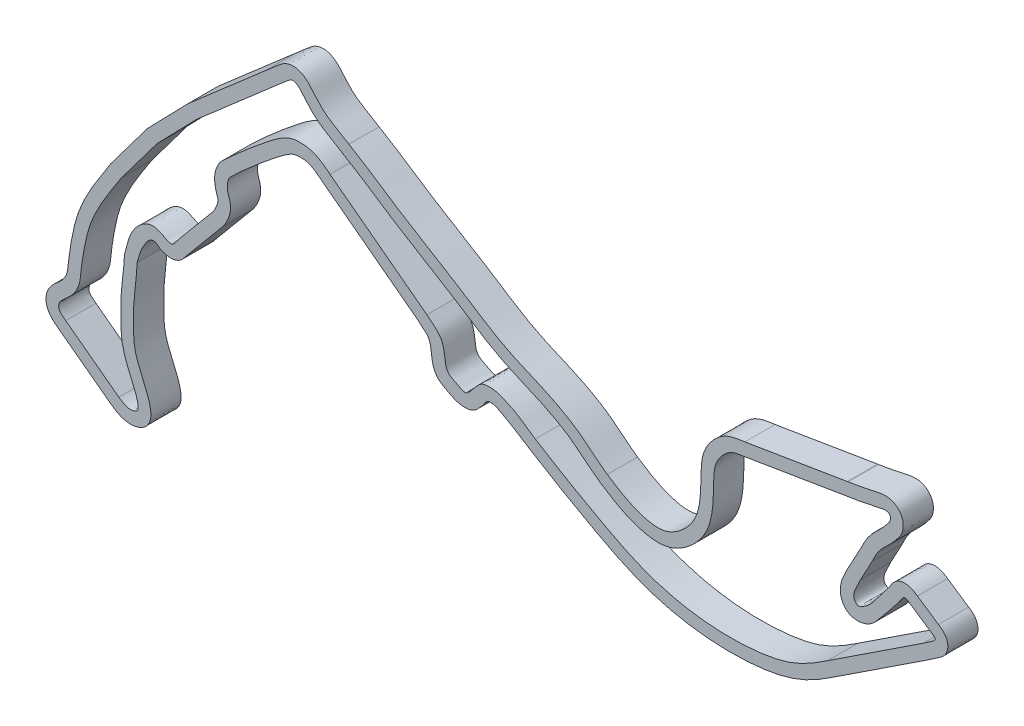
from build123d import *

# Parameters (mm, degrees)
BOSS_EXTRUDE1_DEPTH = 10


with BuildPart() as part:
    # Sketch1 → Boss-Extrude1 (new body)
    with BuildSketch(Plane.XY):
        with BuildLine():
            add(Edge.make_bspline(
                [(196.234526757, 68.630313455), (196.863164007, 68.208189066), (198.137058601, 67.368154228), (200.652516145, 65.805864581), (203.802944502, 64.089898411), (207.645503281, 62.552015627), (210.952028749, 61.795828065), (213.357323761, 61.693823652), (214.947841928, 61.868663308), (216.533068247, 62.334788007), (218.70015008, 63.347315016), (221.368677373, 65.305430073), (223.590618069, 67.769089936), (224.927043037, 69.875454655), (225.701031814, 71.500631519), (226.276899439, 73.263195499), (226.836601338, 75.863075065), (227.105142885, 78.746119853), (227.209174969, 81.80184881), (227.247932708, 83.766687813), (227.285667366, 85.379739898), (227.370084537, 87.155157869), (227.618587659, 89.140469495), (228.268239137, 91.289887574), (229.266557438, 93.447059143), (230.875387167, 95.708061823), (232.753166642, 97.5456105), (234.409057167, 98.728499584), (235.802883373, 99.458190286), (237.243970763, 99.958741433), (238.655976068, 100.28271843), (239.873818858, 100.485156121), (240.923853025, 100.639413146), (241.510026595, 100.721855255), (241.795543314, 100.761883126)],
                knots=[0.000551841, 0.000551841, 0.000551841, 0.000551841, 0.031770571, 0.062989301, 0.125426761, 0.187864221, 0.250301681, 0.281520411, 0.312739141, 0.343957871, 0.375176601, 0.437614061, 0.500051521, 0.531270251, 0.562488981, 0.593707711, 0.624926441, 0.687363901, 0.718582631, 0.74980136, 0.765410725, 0.78102009, 0.81223882, 0.827848185, 0.84345755, 0.87467628, 0.90589501, 0.921504375, 0.93711374, 0.952723105, 0.96833247, 0.983941835, 0.991746518, 0.9995512, 0.9995512, 0.9995512, 0.9995512], degree=3))
            Line((241.795543314, 100.761883126), (275.732195558, 106.3754647))
            Line((275.732195558, 106.3754647), (276.417618534, 102.231771258))
            Line((276.417618534, 102.231771258), (242.42985729, 96.609735563))
            add(Edge.make_bspline(
                [(193.858460131, 65.166788867), (197.968942741, 62.404891637), (204.622812769, 58.416895192), (216.223853845, 56.740775009), (224.585516598, 61.849002139), (230.247353794, 69.676978159), (231.361605554, 77.604093227), (231.444623149, 84.62242306), (231.664088974, 90.31839846), (236.479929402, 95.751342639), (239.166359878, 96.152366989), (242.42985729, 96.609735563)],
                knots=[0, 0, 0, 0, 0.196170733, 0.307152081, 0.445248226, 0.559693045, 0.682149618, 0.754045742, 0.833197903, 0.91443926, 1, 1, 1, 1], degree=3))
            add(Edge.make_bspline(
                [(108.432203873, 116.988121532), (114.126991534, 113.711788129), (125.456933398, 105.623426241), (143.607249619, 95.381303818), (159.43475912, 84.228130675), (173.49140335, 78.985615087), (184.959630652, 72.764552204), (189.446398996, 68.255597223), (193.858460131, 65.166788867)],
                knots=[0, 0, 0, 0, 0.196769887, 0.416049554, 0.62549462, 0.77064201, 0.869433241, 1, 1, 1, 1], degree=3))
            Line((108.432203873, 116.988121532), (110.640197311, 120.563207895))
            add(Edge.make_bspline(
                [(110.640197311, 120.563207895), (111.539005521, 120.044602162), (113.364389861, 118.955106735), (116.949095551, 116.700673271), (121.350772385, 113.782327508), (126.500541127, 110.345587387), (133.414953441, 106.024574697), (140.604074339, 101.80676755), (147.841285424, 97.25990834), (153.095359082, 93.796974998), (157.404572606, 91.076999509), (160.854760386, 89.087856333), (163.438552142, 87.719795895), (166.086380439, 86.468821691), (169.783379136, 84.847787093), (174.635145725, 82.81858748), (179.735034842, 80.367005618), (183.628906038, 78.138626504), (186.411930786, 76.309862657), (188.860256364, 74.422838), (190.751496836, 72.86277083), (192.299404144, 71.601175269), (193.508800918, 70.64081594), (194.587417425, 69.818930313), (195.503447323, 69.148019193), (195.992214942, 68.800176884), (196.234526757, 68.630313455)],
                knots=[0.001261936, 0.001261936, 0.001261936, 0.001261936, 0.031239258, 0.062478515, 0.12495703, 0.187435545, 0.24991406, 0.37487109, 0.437349605, 0.49982812, 0.562306636, 0.593545893, 0.624785151, 0.656024408, 0.687263666, 0.749742181, 0.812220696, 0.843459953, 0.874699211, 0.905938468, 0.937177726, 0.952797355, 0.968416983, 0.984036612, 0.991846427, 0.999656241, 0.999656241, 0.999656241, 0.999656241], degree=3))
        make_face()
        with BuildLine():
            add(Edge.make_bspline(
                [(276.04365442, 106.415089419), (276.299155895, 106.437929753), (276.797673106, 106.49630102), (277.87839754, 106.669646388), (279.335083687, 106.972880573), (280.965327653, 107.337639256), (282.377799228, 107.608525125), (283.350931978, 107.7809387), (284.104769731, 107.919311276), (284.667341005, 108.032175057), (285.066950514, 108.118520959), (285.450546136, 108.210435349), (286.02531704, 108.34900085), (286.769880582, 108.493962676), (287.616814089, 108.606305982), (288.890919489, 108.646388104), (290.329260479, 108.374813902), (291.57125995, 107.794735104), (292.385594642, 107.205316266), (293.009380203, 106.549345384), (293.449598326, 105.934065688), (293.773891696, 105.302196922), (294.060281598, 104.521720877), (294.227425107, 103.655424666), (294.261629951, 102.768150368), (294.194521731, 101.976389095), (293.979975011, 100.943650016), (293.497912114, 99.819644637), (292.999284346, 99.098114788), (292.732758436, 98.749756718), (292.554837392, 98.521312778), (292.302006215, 98.199306834), (291.993376099, 97.815839827), (291.552599937, 97.282584959), (290.957820234, 96.594413151), (290.187660937, 95.757293105), (289.344982558, 94.915873426), (288.580496124, 94.204350942), (287.91097437, 93.579460995), (287.371154179, 93.044436019), (286.882525687, 92.501846379), (286.255176747, 91.7246278), (285.550643183, 90.686637306), (284.739590955, 89.219472439), (284.260669489, 88.226064253), (284.026776041, 87.72492551)],
                knots=[0, 0, 0, 0, 0.03125, 0.0625, 0.125, 0.1875, 0.21875, 0.25, 0.28125, 0.296875, 0.3125, 0.328125, 0.34375, 0.359375, 0.375, 0.390625, 0.40625, 0.4140625, 0.421875, 0.42578125, 0.4296875, 0.43359375, 0.4375, 0.4453125, 0.453125, 0.4609375, 0.46875, 0.484375, 0.5, 0.5078125, 0.515625, 0.53125, 0.546875, 0.5625, 0.59375, 0.625, 0.65625, 0.6875, 0.71875, 0.75, 0.78125, 0.8125, 0.875, 0.9375, 1, 1, 1, 1], degree=3))
            Line((284.026776041, 87.72492551), (280.220890385, 89.501223452))
            add(Edge.make_bspline(
                [(276.417618534, 102.231771258), (278.482091586, 102.416323043), (281.665570829, 103.283360692), (285.4842272, 103.859815501), (287.508942028, 104.40934232), (288.962793997, 104.454912089), (290.005577315, 103.820685535), (290.131788965, 102.264665225), (289.41359955, 101.315737551), (288.355536619, 99.980318492), (286.653931943, 98.072480246), (284.383264838, 96.125101695), (282.038604995, 93.223098974), (280.823061812, 90.791432454), (280.220890385, 89.501223452)],
                knots=[0, 0, 0, 0, 0.198526477, 0.317824383, 0.368633022, 0.403434212, 0.429131062, 0.458812264, 0.50994905, 0.556035233, 0.642710202, 0.745984138, 0.846317161, 1, 1, 1, 1], degree=3))
            Line((276.417618534, 102.231771258), (275.732195558, 106.3754647))
            Line((275.732195558, 106.3754647), (276.04365442, 106.415089419))
        make_face()
        with BuildLine():
            Line((280.220890385, 89.501223452), (284.026776041, 87.72492551))
            Line((284.026776041, 87.72492551), (280.060238423, 80.30371643))
            add(Edge.make_bspline(
                [(280.060238423, 80.30371643), (279.477000914, 78.972480504), (278.307797572, 77.081541577), (277.52724465, 74.107351382), (279.174438317, 72.0876794), (282.092744697, 73.73093624), (283.586581144, 75.111292315), (284.579965548, 76.467035769)],
                knots=[0, 0, 0, 0, 0.27924797, 0.444097265, 0.560672284, 0.683147866, 1, 1, 1, 1], degree=3))
            Line((284.579965548, 76.467035769), (289.658783374, 83.102363405))
            Line((289.658783374, 83.102363405), (293.138496094, 80.750428163))
            add(Edge.make_bspline(
                [(280.220890385, 89.501223452), (278.674648287, 86.742501108), (277.375916867, 84.194823103), (275.569925028, 81.13198679), (273.708208555, 76.875796488), (273.40125974, 74.548178372), (273.351286308, 72.54448391), (274.978100317, 68.93995389), (278.94023944, 67.769867191), (283.795811043, 68.910487154), (287.039243486, 73.197543337), (290.371115907, 77.122403947), (292.266426418, 79.617266062), (293.138496094, 80.750428163)],
                knots=[0, 0, 0, 0, 0.174466526, 0.265326994, 0.299347547, 0.342411784, 0.404117927, 0.480449857, 0.56736615, 0.655825387, 0.794313789, 0.905299734, 1, 1, 1, 1], degree=3))
        make_face()
        with BuildLine():
            add(Edge.make_bspline(
                [(305.92726969, 80.448180257), (306.093232724, 80.352645385), (306.425991862, 80.139773499), (306.982090487, 79.718538813), (307.525162131, 79.241295787), (308.191298999, 78.415556014), (308.718041768, 77.483449926), (309.026616015, 76.315417924), (309.021144085, 75.228347777), (308.860716175, 74.389038617), (308.590180385, 73.687139879), (308.206755757, 72.993429156), (307.753853417, 72.41960435), (307.307059365, 71.972834078), (306.845621327, 71.572898603), (306.320076897, 71.185317568), (305.846033479, 70.881120932), (305.61451272, 70.732235796), (305.265577304, 70.493470687), (304.75455718, 70.125740564), (304.050425508, 69.61435046), (303.471179206, 69.220370649), (303.188253115, 69.040782206)],
                knots=[0.015886482, 0.015886482, 0.015886482, 0.015886482, 0.046485722, 0.077084961, 0.13828344, 0.168882679, 0.199481919, 0.230081158, 0.245380778, 0.260680398, 0.275980017, 0.291279637, 0.321878877, 0.352478116, 0.383077355, 0.444275834, 0.505474313, 0.566672792, 0.627871271, 0.750268229, 0.872665186, 0.995062144, 0.995062144, 0.995062144, 0.995062144], degree=3))
            Line((303.188253115, 69.040782206), (271.546205445, 48.212879095))
            Line((271.546205445, 48.212879095), (269.213594836, 51.705687672))
            Line((269.213594836, 51.705687672), (300.910194421, 72.569498764))
            add(Edge.make_bspline(
                [(303.742516184, 76.85643604), (303.956984321, 76.74917355), (304.585415996, 76.287630482), (304.994814025, 75.606416672), (304.235728841, 74.816635705), (302.883568048, 74.011711938), (301.748536761, 73.098573419), (300.910194421, 72.569498764)],
                knots=[0, 0, 0, 0, 0.119034695, 0.260232138, 0.372325929, 0.544277308, 1, 1, 1, 1], degree=3))
            Line((303.742516184, 76.85643604), (296.582535179, 81.652595564))
            add(Edge.make_bspline(
                [(296.582535179, 81.652595564), (296.114817569, 81.976249139), (294.555836664, 83.132371185), (293.697947968, 81.529078732), (293.416325189, 81.161479207), (293.138496094, 80.750428163)],
                knots=[0, 0, 0, 0, 0.534492278, 0.760270449, 1, 1, 1, 1], degree=3))
            Line((293.138496094, 80.750428163), (289.658783374, 83.102363405))
            add(Edge.make_bspline(
                [(289.658783374, 83.102363405), (289.73067227, 83.208723777), (289.893077033, 83.44494852), (290.036421861, 83.650438607), (290.098200474, 83.742003284), (290.132039851, 83.79524394), (290.154307557, 83.830157137), (290.306193828, 84.091526843), (290.695372778, 84.685906961), (291.312021832, 85.408663866), (292.229646652, 86.076563033), (293.396871504, 86.608006548), (294.731009259, 86.778683237), (295.926310875, 86.618783106), (296.79727698, 86.343159187), (297.686056707, 85.94314899), (298.311917686, 85.558051256), (298.696893289, 85.298203182), (298.867876708, 85.179268764), (298.918970655, 85.143516601), (298.948848463, 85.122720792)],
                knots=[0.012212635, 0.012212635, 0.012212635, 0.012212635, 0.073949345, 0.135686055, 0.197422766, 0.228291121, 0.259159476, 0.320896186, 0.382632897, 0.444369607, 0.475237962, 0.506106317, 0.567843028, 0.629579738, 0.691316448, 0.753053159, 0.876526579, 0.93826329, 0.969131645, 1, 1, 1, 1], degree=3))
            Line((298.948848463, 85.122720792), (305.92726969, 80.448180257))
        make_face()
        with BuildLine():
            add(Edge.make_bspline(
                [(271.546205503, 48.212879009), (270.620460869, 47.585790746), (268.764244878, 46.357883466), (264.806941907, 43.952698497), (260.537185549, 41.808258006), (255.892917883, 40.244314872), (251.241949023, 39.124858427), (245.492051708, 38.327714536), (238.645366833, 37.931755154), (231.795226509, 38.077062764), (224.961471705, 38.747155832), (218.189580197, 39.9576266), (211.523186447, 41.717461835), (205.005983268, 44.086446109), (198.827581147, 46.953217942), (192.927765951, 50.037139068), (187.138367736, 53.211573705), (179.508766989, 57.584923137), (173.887844393, 60.982024439), (170.157171773, 63.284923002)],
                knots=[0.00026236, 0.00026236, 0.00026236, 0.00026236, 0.03125, 0.0625, 0.125, 0.15625, 0.1875, 0.25, 0.3125, 0.375, 0.4375, 0.5, 0.5625, 0.625, 0.6875, 0.75, 0.8125, 0.875, 1, 1, 1, 1], degree=3))
            Line((170.157171773, 63.284923002), (172.363312299, 66.858848571))
            add(Edge.make_bspline(
                [(269.213594836, 51.705687672), (265.352346861, 49.089092099), (258.203080371, 44.718538332), (246.636731226, 42.531714881), (234.837467273, 41.932015281), (221.984186902, 43.154349494), (208.301381604, 46.909771316), (191.889505447, 55.121057261), (180.069174411, 62.102114173), (172.363312299, 66.858848571)],
                knots=[0, 0, 0, 0, 0.134956463, 0.235935992, 0.334652586, 0.474283315, 0.604979452, 0.739944456, 1, 1, 1, 1], degree=3))
            Line((269.213594836, 51.705687672), (271.546205503, 48.212879009))
        make_face()
        with BuildLine():
            add(Edge.make_bspline(
                [(170.157171773, 63.284923002), (167.380133003, 64.952711691), (166.372828029, 65.841047959), (160.719319849, 69.026201898), (158.746460715, 69.969275373), (156.265754069, 69.98784721), (155.267232466, 68.070760863), (154.437192689, 67.246289961), (153.304827873, 65.966162239), (151.745117878, 64.566267304), (148.518765615, 64.087755945), (145.668492532, 64.770079215), (143.680306718, 65.882687863), (139.652907626, 67.917678619), (138.219368379, 71.666636073), (137.917364345, 74.679605716), (137.428464828, 78.805827416), (134.769008456, 80.254731346), (133.912506976, 81.227482231)],
                knots=[0, 0, 0, 0, 0.123450084, 0.236002716, 0.282672016, 0.306033513, 0.348776375, 0.389670255, 0.423044825, 0.46383169, 0.501053483, 0.56576885, 0.642012372, 0.72022496, 0.772139811, 0.834227562, 0.919451679, 1, 1, 1, 1], degree=3))
            Line((133.912506976, 81.227482231), (136.443466461, 84.579234621))
            add(Edge.make_bspline(
                [(136.443466461, 84.579234621), (137.943775766, 83.309730923), (140.779540894, 81.318090614), (142.100230111, 77.741788176), (142.452388046, 74.342266724), (143.006811958, 71.427354301), (145.96797475, 69.869598407), (146.410571412, 69.668559653), (149.339916819, 68.182996702), (151.560863968, 70.595035304), (152.422729871, 71.612818877), (153.819132859, 73.4833356), (155.747760375, 74.20779108), (158.524539628, 74.277365076), (160.542118229, 73.647174524), (166.59457107, 71.285117638), (169.379416565, 68.699889806), (172.363312299, 66.858848571)],
                knots=[0, 0, 0, 0, 0.127325144, 0.186001512, 0.25706188, 0.315269087, 0.365632107, 0.421646536, 0.444492197, 0.468790974, 0.521671547, 0.589821917, 0.615464301, 0.648895055, 0.698590013, 0.793174288, 1, 1, 1, 1], degree=3))
            Line((172.363312299, 66.858848571), (170.157171773, 63.284923002))
        make_face()
        with BuildLine():
            add(Edge.make_bspline(
                [(101.605185531, 105.63693244), (101.20970175, 105.983051146), (100.397129697, 106.645334061), (99.083182196, 107.551965512), (97.834474782, 108.223692086), (96.871419219, 108.567857905), (96.013398806, 108.728992202), (95.204810719, 108.795053989), (94.487925669, 108.812988831), (93.785242673, 108.798102506), (93.184083281, 108.740442773), (92.626533647, 108.629156851), (92.135204706, 108.474207312), (91.462857102, 108.166658644), (90.395607304, 107.563643877), (88.945129676, 106.582859835), (87.532982541, 105.538786408), (85.902040195, 104.232603343), (84.258908787, 102.898971871), (82.629100513, 101.595454102), (81.342468867, 100.53388605), (79.87949785, 99.271981265), (78.3987106, 97.966230195), (77.184849931, 96.890093496), (76.403762882, 96.231395127), (76.133082084, 96.014257718), (75.579693906, 95.529653589), (74.914638203, 94.932862251), (73.871543369, 93.98459743), (72.613064723, 92.822748775), (71.530057099, 91.787694891), (71.154749414, 91.357000843), (71.084087368, 91.25686975), (70.733635264, 90.55752789), (70.452079941, 89.708812204), (70.343522781, 89.091365679), (70.316118704, 88.347875304), (70.377212901, 87.566504284), (70.473788033, 86.96992645), (70.585356483, 86.524465578), (70.704286493, 86.138162952), (70.859417841, 85.682414063), (71.176277156, 84.769648972), (71.396636525, 83.453559907), (71.428838775, 82.307326989), (71.244289903, 81.04835524), (70.945576225, 80.047329358), (70.613313587, 79.183413027), (70.15636924, 78.186429557), (69.667288082, 77.260635184), (69.197823881, 76.530305746), (68.930931863, 76.176094332), (68.901393906, 76.137518233)],
                knots=[0, 0, 0, 0, 0.03125, 0.0625, 0.09375, 0.125, 0.15625, 0.171875, 0.1875, 0.203125, 0.21875, 0.234375, 0.25, 0.265625, 0.28125, 0.3125, 0.34375, 0.375, 0.4375, 0.46875, 0.5, 0.53125, 0.5625, 0.59375, 0.625, 0.65625, 0.671875, 0.6875, 0.703125, 0.71875, 0.734375, 0.75, 0.765625, 0.78125, 0.796875, 0.8125, 0.828125, 0.84375, 0.859375, 0.875, 0.8828125, 0.890625, 0.90625, 0.9140625, 0.921875, 0.9296875, 0.9375, 0.9453125, 0.953125, 0.96875, 0.984375, 0.986313598, 0.986313598, 0.986313598, 0.986313598], degree=3))
            Line((68.901393906, 76.137518233), (68.424560197, 75.56665383))
            Line((68.424560197, 75.56665383), (57.316582805, 62.269182917))
            Line((57.316582805, 62.269182917), (54.763492291, 65.764142403))
            Line((54.763492291, 65.764142403), (65.211176672, 78.271169944))
            add(Edge.make_bspline(
                [(104.371223507, 108.797475734), (102.836290894, 110.140814997), (99.405106134, 112.570950803), (95.0966284, 113.139045485), (90.836320599, 112.830549689), (85.873639281, 109.669313906), (82.490609642, 106.823962099), (78.7229225, 103.906560661), (73.345751803, 99.065742071), (73.64622818, 99.480235336), (68.470528172, 94.728304147), (67.318520196, 93.385125104), (66.083437979, 90.230726336), (66.11431921, 87.014798249), (66.661955224, 84.790456542), (67.56698189, 82.596732778), (66.115279653, 79.39929269), (65.580595085, 78.669907528), (65.211176672, 78.271169944)],
                knots=[0, 0, 0, 0, 0.104551917, 0.186642968, 0.247572531, 0.305959362, 0.401525643, 0.505854823, 0.603404042, 0.695409784, 0.731087321, 0.768287257, 0.802740865, 0.839401753, 0.88497536, 0.92668872, 0.95917769, 1, 1, 1, 1], degree=3))
            Line((104.371223507, 108.797475734), (136.443466461, 84.579234621))
            Line((136.443466461, 84.579234621), (133.912506976, 81.227482231))
            Line((133.912506976, 81.227482231), (101.840264022, 105.445723344))
            Line((101.840264022, 105.445723344), (101.605185531, 105.63693244))
        make_face()
        with BuildLine():
            add(Edge.make_bspline(
                [(36.259626171, 51.705687672), (36.910333552, 54.2439184), (37.752477025, 58.594242921), (41.204126021, 63.013368217), (45.186895344, 65.185013018), (48.585736981, 64.007062876), (51.92408093, 61.897749898), (53.154091345, 63.70328518), (54.352206848, 65.209665859), (54.763492291, 65.764142403)],
                knots=[0, 0, 0, 0, 0.285198539, 0.458660634, 0.594042106, 0.732518411, 0.842679554, 0.937288779, 1, 1, 1, 1], degree=3))
            Line((54.763492291, 65.764142403), (57.316582805, 62.269182917))
            add(Edge.make_bspline(
                [(57.316582805, 62.269182917), (56.811781101, 61.592789282), (55.626635247, 60.077702462), (54.367705866, 58.99858974), (51.845238149, 58.141239947), (48.739792092, 58.811923515), (47.773182928, 59.590019693), (46.110800502, 60.796172592), (44.188372833, 59.962269374), (42.601515826, 57.448739648), (41.515040509, 55.365844442), (41.52807158, 55.089597052), (40.456442371, 51.542182993)],
                knots=[0, 0, 0, 0, 0.113185253, 0.204195792, 0.294310545, 0.385662809, 0.482413435, 0.552192122, 0.610710536, 0.674628887, 0.786453366, 1, 1, 1, 1], degree=3))
            Line((40.456442371, 51.542182993), (36.259626171, 51.705687672))
        make_face()
        with BuildLine():
            Line((43.865503126, 91.715388497), (31.731745539, 75.550993282))
            add(Edge.make_bspline(
                [(31.731745539, 75.550993282), (31.427397601, 75.070586811), (30.820032811, 74.118617853), (29.560052243, 72.165922279), (27.943373803, 69.658798928), (26.001846375, 66.525692684), (24.134236042, 63.255177689), (22.416396077, 59.828334009), (21.178853574, 56.82478023), (20.347716096, 54.326361063), (19.645750258, 51.756323724), (19.030281301, 48.742045905), (18.456545864, 45.790106236), (18.058064943, 43.323508611), (17.802975508, 41.428118952), (17.628777075, 39.528847347), (17.460047843, 38.013543921), (17.213754645, 36.883353281), (16.80963657, 35.828062853), (16.347388421, 35.026857308), (15.894415804, 34.419277345), (15.537005407, 34.009521895), (15.079496699, 33.553270007), (14.521208413, 33.043300884), (13.858705379, 32.459547842), (13.155764267, 31.827638267), (12.251399218, 30.971711042), (11.299841711, 29.763374469), (10.675529279, 28.418560136), (10.372473329, 27.346637246), (10.233683861, 26.177781961), (10.322475165, 24.853342364), (10.74942314, 23.498874522), (11.335742498, 22.473339571), (11.962912467, 21.678073984), (12.566826, 21.069497997), (13.119620306, 20.591033245), (13.599187576, 20.2141438), (13.998060946, 19.91362583), (14.160631373, 19.788652336), (14.253769432, 19.715376382)],
                knots=[-0.000971814, -0.000971814, -0.000971814, -0.000971814, 0.030403258, 0.061778331, 0.124528475, 0.18727862, 0.250028765, 0.31277891, 0.375529054, 0.406904127, 0.438279199, 0.501029344, 0.563779489, 0.595154561, 0.626529633, 0.657904706, 0.689279778, 0.720654851, 0.752029923, 0.783404995, 0.799092532, 0.814780068, 0.830467604, 0.84615514, 0.861842676, 0.877530212, 0.893217749, 0.908905285, 0.916749053, 0.924592821, 0.932436589, 0.940280357, 0.948124125, 0.955967893, 0.963811662, 0.97165543, 0.979499198, 0.987342966, 0.995186734, 1.003030502, 1.003030502, 1.003030502, 1.003030502], degree=3))
            Line((14.253769432, 19.715376382), (31.888554379, 6.530211504))
            Line((31.888554379, 6.530211504), (34.403555749, 9.893954673))
            Line((34.403555749, 9.893954673), (16.810133984, 23.048193153))
            add(Edge.make_bspline(
                [(16.810133984, 23.048193153), (15.964717147, 23.7133211), (14.202469586, 24.830853131), (14.618875432, 27.380333665), (16.407311962, 29.180775848), (18.701953676, 31.006240932), (20.517380027, 33.650628378), (21.648539358, 36.75730128), (21.942533137, 41.599551655), (22.947278313, 46.979513465), (25.374645, 58.665004124), (31.110861447, 66.722904367), (35.190615426, 73.162705542)],
                knots=[0, 0, 0, 0, 0.060723138, 0.08878071, 0.124345394, 0.192969272, 0.244850651, 0.292339704, 0.366969472, 0.500939712, 0.583564432, 1, 1, 1, 1], degree=3))
            Line((35.190615426, 73.162705542), (47.064631455, 88.981077265))
            Line((47.064631455, 88.981077265), (60.206496457, 102.519840363))
            Line((60.206496457, 102.519840363), (85.701256015, 124.687115384))
            add(Edge.make_bspline(
                [(85.701256015, 124.687115384), (86.981619211, 125.920752088), (88.865261958, 127.27705958), (92.218296027, 130.542873982), (94.939692201, 127.829808005), (96.954603137, 125.285425815), (100.995303287, 121.005537199), (105.523488971, 118.917403177), (108.432203873, 116.988121532)],
                knots=[0, 0, 0, 0, 0.172513245, 0.280368886, 0.402846356, 0.488049957, 0.63627094, 1, 1, 1, 1], degree=3))
            Line((108.432203873, 116.988121532), (110.640197657, 120.563208494))
            add(Edge.make_bspline(
                [(110.640197657, 120.563208494), (110.129626413, 120.899153273), (109.038725027, 121.580264908), (107.478337002, 122.496081154), (105.957932576, 123.38481678), (104.554554793, 124.248475519), (103.275681014, 125.124441263), (102.167489623, 126.008412494), (101.095085501, 127.035519024), (100.217498608, 127.997300706), (99.555179826, 128.783578296), (98.990689092, 129.470181061), (98.335824691, 130.243103174), (97.529720021, 131.138109868), (96.621357265, 132.002273823), (95.672445693, 132.69790432), (94.795188547, 133.199774504), (93.687862623, 133.624087198), (92.531861916, 133.809107664), (91.51101909, 133.760300764), (90.596177924, 133.594934347), (89.642438698, 133.247639691), (88.770248152, 132.76305619), (87.85906035, 132.122198561), (87.024588188, 131.387259656), (86.407278857, 130.830695086), (85.776923341, 130.299755286), (85.121336807, 129.75935129), (84.418641654, 129.177533477), (83.6751465, 128.53945054), (83.127989541, 128.03774291), (82.867773099, 127.789045509)],
                knots=[0.007386199, 0.007386199, 0.007386199, 0.007386199, 0.065384872, 0.127692548, 0.190000223, 0.252307898, 0.314615573, 0.376923248, 0.439230923, 0.501538599, 0.532692436, 0.563846274, 0.595000111, 0.626153949, 0.657307787, 0.672884705, 0.688461624, 0.704038543, 0.719615462, 0.727403921, 0.735192381, 0.750769299, 0.766346218, 0.781923137, 0.813076974, 0.844230812, 0.87538465, 0.906538487, 0.937692325, 0.968846162, 1, 1, 1, 1], degree=3))
            Line((82.867773099, 127.789045509), (57.316582864, 105.572704941))
            Line((57.316582864, 105.572704941), (43.865503126, 91.715388497))
        make_face()
        with BuildLine():
            Line((31.888554379, 6.530211504), (31.916902306, 6.50920141))
            add(Edge.make_bspline(
                [(31.916902306, 6.50920141), (32.185382679, 6.311958777), (32.706789191, 5.944203616), (33.989218697, 5.155771745), (35.575421903, 4.440552944), (37.565725958, 4.068420121), (39.227711302, 4.086067609), (40.636279498, 4.387908058), (41.87999535, 4.908931517), (42.885931664, 5.535948937), (43.749715867, 6.364477559), (44.363028038, 7.315257267), (44.784089883, 8.275535519), (45.010894546, 9.352752243), (45.046419272, 10.719460257), (44.901703382, 11.63480417), (44.776951624, 12.313774082), (44.626715346, 13.005575223), (44.412980929, 13.816369546), (44.123180743, 14.727262699), (43.816127987, 15.578476692), (43.38505456, 16.675885158), (42.82701238, 17.972519688), (42.186963626, 19.415093999), (41.580665849, 20.814065473), (40.840767473, 22.617314052), (40.102254326, 24.723970064), (39.628773251, 26.798290336), (39.405082327, 28.604019141), (39.272980025, 30.65490582), (39.252645603, 32.880921168), (39.24953976, 34.988047), (39.258567387, 36.901166656), (39.315040415, 39.05395772), (39.5352631, 41.640400462), (39.879259111, 44.590602397), (40.176170698, 47.317528864), (40.363888539, 49.66296145), (40.432304415, 50.922613175), (40.456442371, 51.542182993)],
                knots=[0, 0, 0, 0, 0.015625, 0.03125, 0.0625, 0.078125, 0.09375, 0.109375, 0.1171875, 0.125, 0.1328125, 0.13671875, 0.140625, 0.1484375, 0.15625, 0.171875, 0.1796875, 0.1875, 0.203125, 0.21875, 0.234375, 0.25, 0.28125, 0.3125, 0.34375, 0.375, 0.4375, 0.5, 0.53125, 0.5625, 0.625, 0.65625, 0.6875, 0.75, 0.8125, 0.875, 0.9375, 0.96875, 1, 1, 1, 1], degree=3))
            Line((40.456442371, 51.542182993), (36.259626171, 51.705687672))
            add(Edge.make_bspline(
                [(34.403555749, 9.893954673), (35.720844443, 8.926191232), (37.887554635, 7.689964956), (40.982837443, 9.071230636), (40.736016883, 11.447061726), (40.012165889, 13.94575712), (38.40554535, 17.578873336), (36.405747098, 22.141107345), (35.081636042, 27.411009668), (35.042198766, 34.441836603), (35.06178794, 41.368530336), (36.086850225, 47.270897848), (36.259626171, 51.705687672)],
                knots=[0, 0, 0, 0, 0.099784015, 0.13540387, 0.172333708, 0.224242356, 0.296981847, 0.406910585, 0.519479313, 0.632547135, 0.765852774, 1, 1, 1, 1], degree=3))
            Line((34.403555749, 9.893954673), (31.888554379, 6.530211504))
        make_face()
    extrude(amount=BOSS_EXTRUDE1_DEPTH)


solid = part.part
